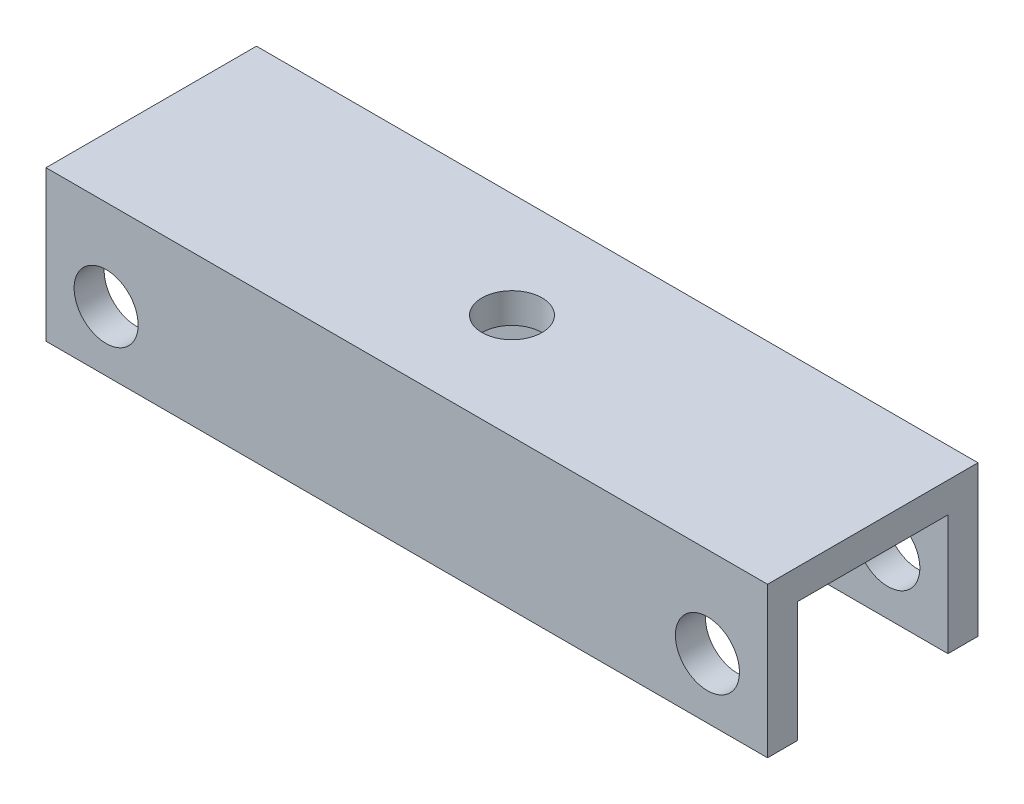
from build123d import *

# Parameters (mm, degrees)
BOSS_EXTRUDE3_DEPTH = 152.4
CUT_EXTRUDE3_REACH  = 161.569
SKETCH7_R           = 6.35
SKETCH8_R           = 6.763254826
CUT_EXTRUDE4_DEPTH  = 162.893869557


with BuildPart() as part:
    # Sketch6 → Boss-Extrude3 (new body)
    with BuildSketch(Plane(origin=(0, 0, 0), x_dir=(0, 0, -1), z_dir=(1, 0, 0))):
        Polygon((-35.048704326, 0), (9.401295674, 0), (9.401295674, -31.75), (3.051295674, -31.75), (3.051295674, -6.35), (-28.698704326, -6.35), (-28.698704326, -31.75), (-35.048704326, -31.75), align=None)
    extrude(amount=BOSS_EXTRUDE3_DEPTH)

    # Sketch7 → Cut-Extrude3 (cut, up to next)
    with BuildSketch(Plane(origin=(0, 0, 0), x_dir=(1, 0, 0), z_dir=(0, 1, 0)), mode=Mode.PRIVATE) as cut_extrude3_sk1:
        with Locations(Location((76.2, -12.823704326, 0), (0, 0, 270))):
            Circle(SKETCH7_R)
    cut_extrude3_tool1 = extrude(cut_extrude3_sk1.sketch, amount=-CUT_EXTRUDE3_REACH, mode=Mode.PRIVATE) & part.part
    add(cut_extrude3_tool1.solids().sort_by_distance((76.2, 0, 12.823704))[0], mode=Mode.SUBTRACT)

    # Sketch8 → Cut-Extrude4 (cut, through all)
    with BuildSketch(Plane.XY.offset(35.048704326)):
        with Locations((12.7, -19.05)):
            Circle(SKETCH8_R)
        with Locations(Location((139.7, -19.05, 0), (0, 0, 180))):
            Circle(SKETCH8_R)
    extrude(amount=-CUT_EXTRUDE4_DEPTH, mode=Mode.SUBTRACT)


solid = part.part
